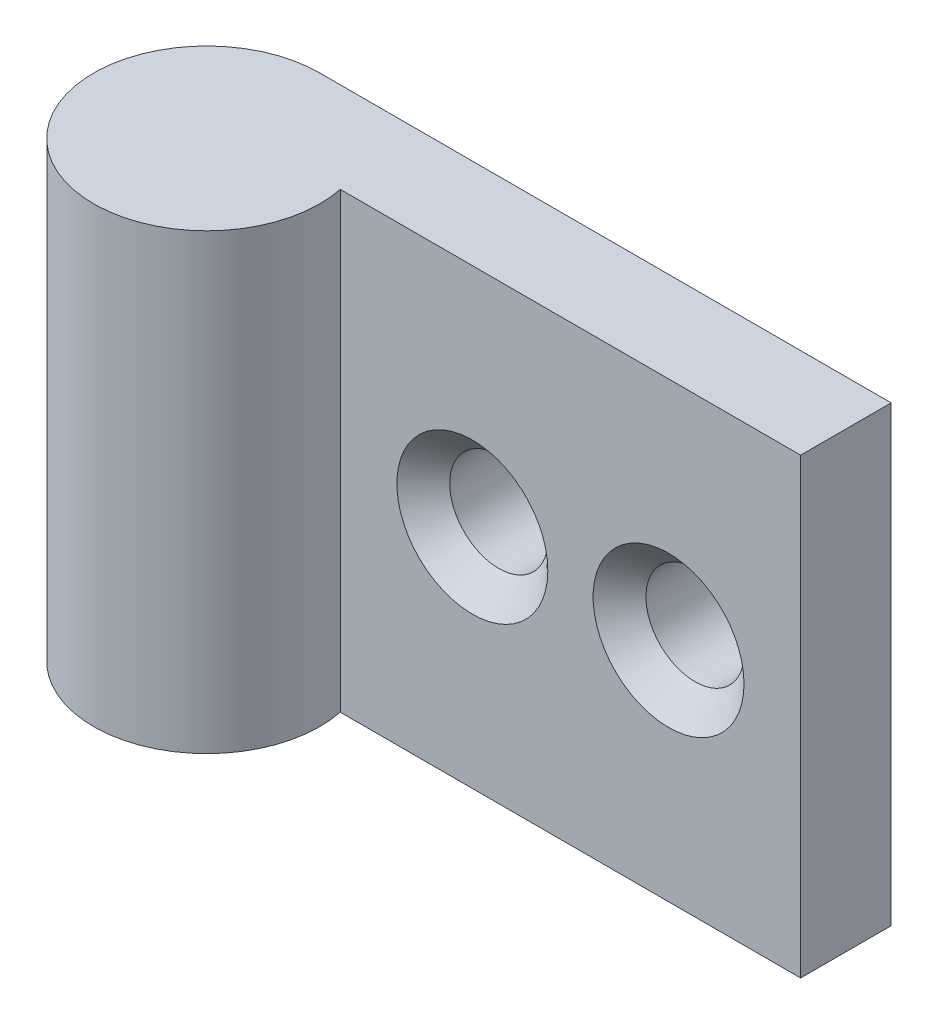
from build123d import *

# Parameters (mm, degrees)
SKETCH_1_W                   = 30.5
SKETCH_1_H                   = 30
EXTRUDE_1_DEPTH              = 6
HOLE_WIZARD_M6_1_D           = 6.5
HOLE_WIZARD_M6_1_CSINK_D     = 10
HOLE_WIZARD_M6_1_CSINK_ANGLE = 90
EXTRUDE_3_DEPTH              = 30


with BuildPart() as part:
    # 草图1 → 凸台-拉伸1 (new body)
    with BuildSketch(Plane.XY):
        with Locations((15.25, -15)):
            Rectangle(SKETCH_1_W, SKETCH_1_H)
    extrude(amount=EXTRUDE_1_DEPTH)

    # M6 内六角花形半沉头螺钉的锥形沉头孔1 (through all)
    with Locations(Plane.XY.offset(6)):
        with Locations((8.75, -15), (21.75, -15)):
            CounterSinkHole(HOLE_WIZARD_M6_1_D / 2, HOLE_WIZARD_M6_1_CSINK_D / 2, counter_sink_angle=HOLE_WIZARD_M6_1_CSINK_ANGLE)

    # 草图5 → 凸台-拉伸3 (add)
    with BuildSketch(Plane.XZ.offset(30)):
        with BuildLine():
            ThreePointArc((0.151530772, 7.5), (-12.597922496, 12.856607172), (-7.5, 0.001530928))
            Line((-7.5, 0.001530928), (-7.5, 6))
            Line((-7.5, 6), (0, 6))
            ThreePointArc((0, 6), (0.113551919, 6.746182785), (0.151530772, 7.5))
        make_face()
        with BuildLine():
            ThreePointArc((-7.5, 0.001530928), (-7.424238481, 0.000382742), (-7.348469228, 0))
            ThreePointArc((-7.348469228, 0), (-2.605052738, 1.690524981), (0, 6))
            Line((0, 6), (-7.5, 6))
            Line((-7.5, 6), (-7.5, 0.001530928))
        make_face()
        with BuildLine():
            Line((-7.348469228, 0), (0, 0))
            Line((0, 0), (0, 6))
            ThreePointArc((0, 6), (-2.605052738, 1.690524981), (-7.348469228, 0))
        make_face()
    extrude(amount=-EXTRUDE_3_DEPTH)


solid = part.part
